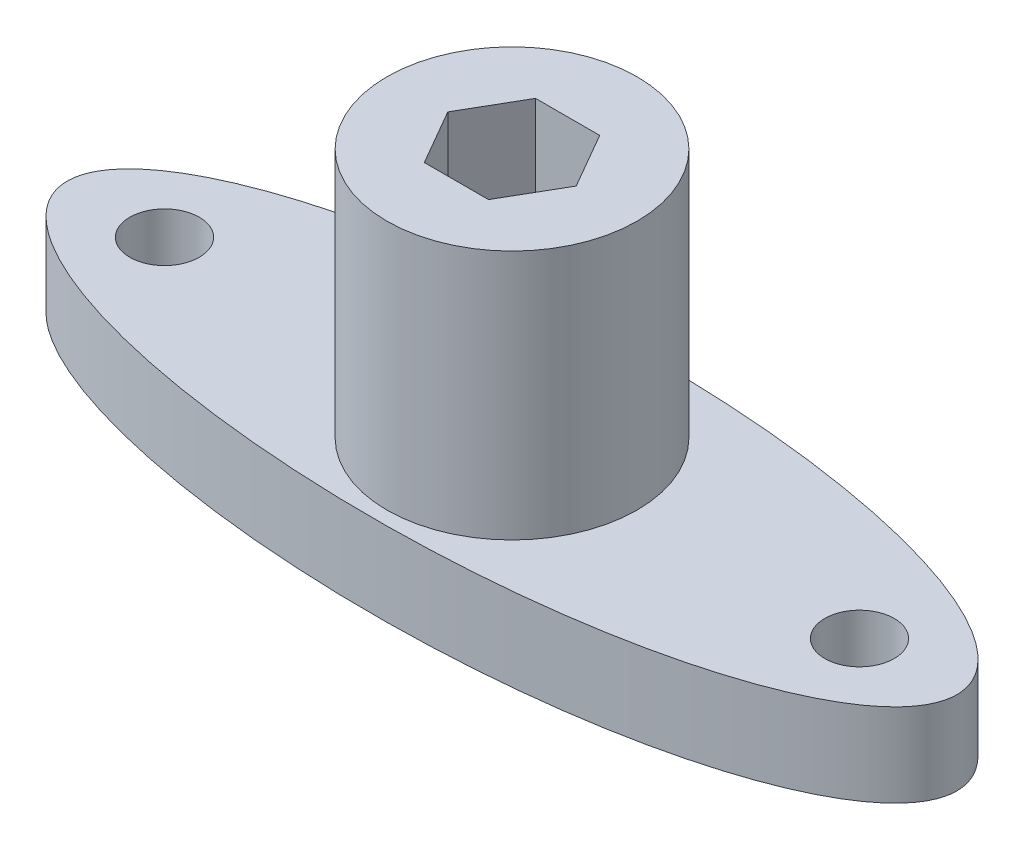
from build123d import *

# Parameters (mm, degrees)
SKETCH1_RX          = 20.32
SKETCH1_RY          = 6.35
SKETCH1_R           = 1.5875
SKETCH1_R_2         = 5.715
BOSS_EXTRUDE1_DEPTH = 3.81
BOSS_EXTRUDE2_START = 3.81
SKETCH1_3_R         = 5.715
BOSS_EXTRUDE2_DEPTH = 3.81
BOSS_EXTRUDE3_START = 3.81
SKETCH1_4_R         = 5.715
BOSS_EXTRUDE3_DEPTH = 11.43


with BuildPart() as part:
    # Sketch1 → Boss-Extrude1 (new body)
    # profile 1 of 3: a face of its own
    with BuildSketch(Plane(origin=(0, 0, 0), x_dir=(1, 0, 0), z_dir=(0, 1, 0))):
        with Locations((0, 0)):
            Ellipse(SKETCH1_RX, SKETCH1_RY)
        with Locations(Location((-15.875, 0, 0), (0, 0, 90))):
            Circle(SKETCH1_R, mode=Mode.SUBTRACT)
        with Locations(Location((15.875, 0, 0), (0, 0, 90))):
            Circle(SKETCH1_R, mode=Mode.SUBTRACT)
        Circle(SKETCH1_R_2, mode=Mode.SUBTRACT)
    # profile 2 of 3: a face of its own
    with BuildSketch(Plane(origin=(0, 0, 0), x_dir=(1, 0, 0), z_dir=(0, 1, 0))):
        Circle(SKETCH1_R_2)
        Polygon((1.466469684, -2.54), (2.932939367, 0), (1.466469684, 2.54), (-1.466469684, 2.54), (-2.932939367, 0), (-1.466469684, -2.54), align=None, mode=Mode.SUBTRACT)
    # profile 3 of 3: a face of its own
    with BuildSketch(Plane(origin=(0, 0, 0), x_dir=(1, 0, 0), z_dir=(0, 1, 0))):
        Polygon((-1.466469684, -2.54), (1.466469684, -2.54), (2.932939367, 0), (1.466469684, 2.54), (-1.466469684, 2.54), (-2.932939367, 0), align=None)
    extrude(amount=BOSS_EXTRUDE1_DEPTH)

    # Sketch1<3> → Boss-Extrude2 (add)
    # profile 1 of 2: a face of its own
    with BuildSketch(Plane(origin=(0, 0, 0), x_dir=(1, 0, 0), z_dir=(0, 1, 0)).offset(BOSS_EXTRUDE2_START)):
        with Locations(Location((0, 0, 0), (0, 0, 90))):
            Circle(SKETCH1_3_R)
        Polygon((1.466469684, -2.54), (2.932939367, 0), (1.466469684, 2.54), (-1.466469684, 2.54), (-2.932939367, 0), (-1.466469684, -2.54), align=None, mode=Mode.SUBTRACT)
    # profile 2 of 2: a face of its own
    with BuildSketch(Plane(origin=(0, 0, 0), x_dir=(1, 0, 0), z_dir=(0, 1, 0)).offset(BOSS_EXTRUDE2_START)):
        Polygon((-1.466469684, -2.54), (1.466469684, -2.54), (2.932939367, 0), (1.466469684, 2.54), (-1.466469684, 2.54), (-2.932939367, 0), align=None)
    extrude(amount=BOSS_EXTRUDE2_DEPTH)

    # Sketch1<4> → Boss-Extrude3 (add)
    with BuildSketch(Plane(origin=(0, 0, 0), x_dir=(1, 0, 0), z_dir=(0, 1, 0)).offset(BOSS_EXTRUDE3_START)):
        with Locations(Location((0, 0, 0), (0, 0, 90))):
            Circle(SKETCH1_4_R)
        Polygon((1.466469684, -2.54), (2.932939367, 0), (1.466469684, 2.54), (-1.466469684, 2.54), (-2.932939367, 0), (-1.466469684, -2.54), align=None, mode=Mode.SUBTRACT)
    extrude(amount=BOSS_EXTRUDE3_DEPTH)


solid = part.part
